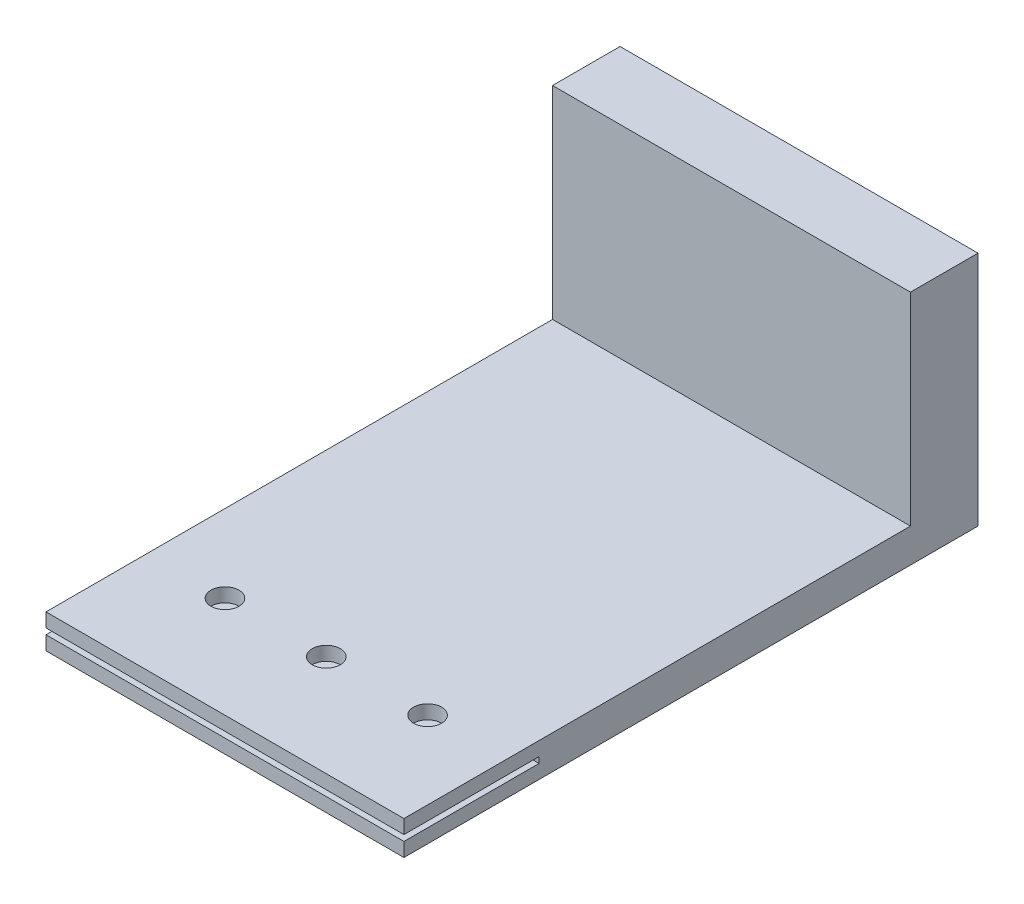
from build123d import *

# Parameters (mm, degrees)
SKETCH4_W           = 106
SKETCH4_H           = 170
BOSS_EXTRUDE4_DEPTH = 10
SKETCH5_W           = 106
SKETCH5_H           = 20
BOSS_EXTRUDE5_DEPTH = 60
SKETCH6_W           = 106
SKETCH6_H           = 1.75
CUT_EXTRUDE2_DEPTH  = 40
SKETCH7_R           = 4.15
CUT_EXTRUDE3_DEPTH  = 40
SKETCH8_W           = 106
SKETCH8_H           = 60
CUT_EXTRUDE4_DEPTH  = 40


with BuildPart() as part:
    # Sketch4 → Boss-Extrude4 (new body)
    with BuildSketch(Plane(origin=(0, 0, 0), x_dir=(1, 0, 0), z_dir=(0, 1, 0))):
        Rectangle(SKETCH4_W, SKETCH4_H)
    extrude(amount=BOSS_EXTRUDE4_DEPTH)

    # Sketch5 → Boss-Extrude5 (add)
    with BuildSketch(Plane(origin=(0, 10, 0), x_dir=(1, 0, 0), z_dir=(0, 1, 0))):
        with Locations((0, 75)):
            Rectangle(SKETCH5_W, SKETCH5_H)
        with Locations((0, -75)):
            Rectangle(SKETCH5_W, SKETCH5_H)
    extrude(amount=BOSS_EXTRUDE5_DEPTH)

    # Sketch6 → Cut-Extrude2 (cut)
    with BuildSketch(Plane.XY.offset(85)):
        with Locations((0, 5)):
            Rectangle(SKETCH6_W, SKETCH6_H)
    extrude(amount=-CUT_EXTRUDE2_DEPTH, mode=Mode.SUBTRACT)

    # Sketch7 → Cut-Extrude3 (cut)
    with BuildSketch(Plane(origin=(0, 10, 0), x_dir=(1, 0, 0), z_dir=(0, 1, 0))):
        with Locations(Location((0, -55, 0), (0, 0, 90))):
            Circle(SKETCH7_R)
        with Locations(Location((30, -55, 0), (0, 0, 90))):
            Circle(SKETCH7_R)
        with Locations(Location((-30, -55, 0), (0, 0, 90))):
            Circle(SKETCH7_R)
    extrude(amount=-CUT_EXTRUDE3_DEPTH, mode=Mode.SUBTRACT)

    # Sketch8 → Cut-Extrude4 (cut)
    with BuildSketch(Plane(origin=(0, 0, 65), x_dir=(-1, 0, 0), z_dir=(0, 0, -1))):
        with Locations((0, 40)):
            Rectangle(SKETCH8_W, SKETCH8_H)
    extrude(amount=-CUT_EXTRUDE4_DEPTH, mode=Mode.SUBTRACT)


solid = part.part
